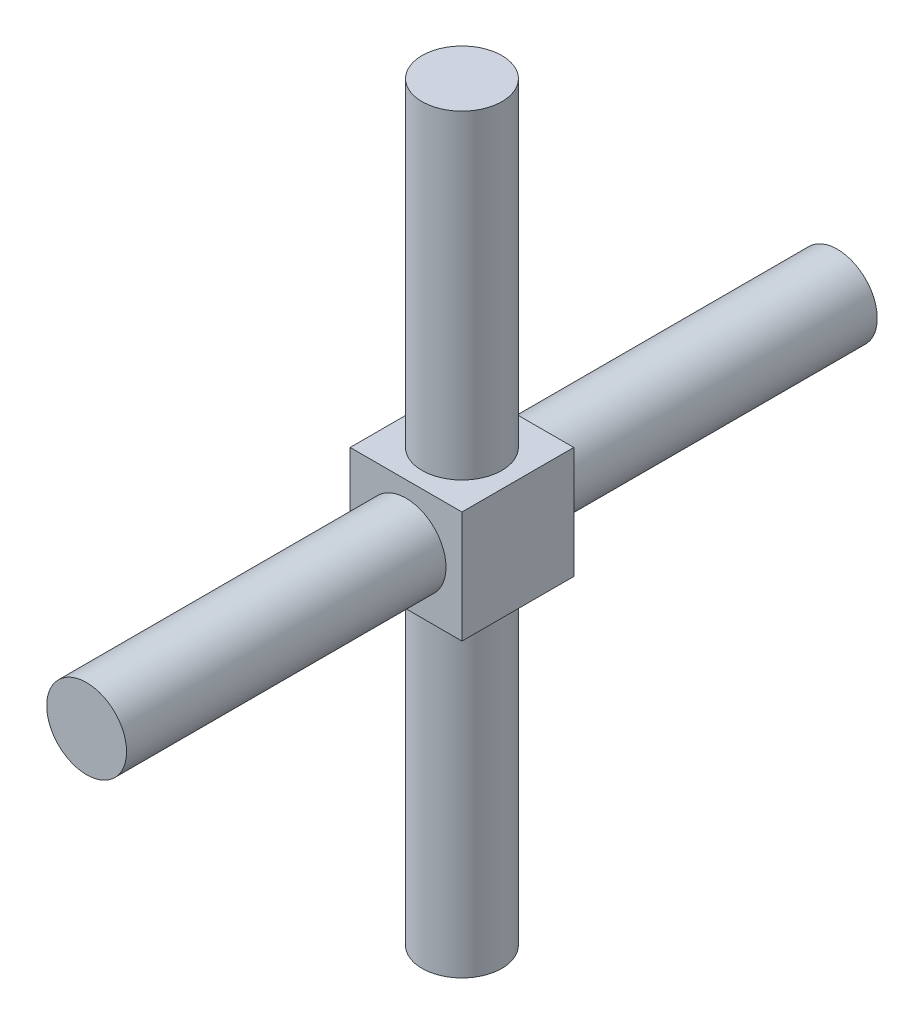
from build123d import *

# Parameters (mm, degrees)
SKETCH_1_W      = 70
SKETCH_1_H      = 70
EXTRUDE_1_DEPTH = 70
SKETCH_4_R      = 25
EXTRUDE_2_DEPTH = 200
SKETCH_5_R      = 25
EXTRUDE_3_DEPTH = 200


with BuildPart() as part:
    # 스케치1 → 보스-돌출1 (new body)
    with BuildSketch(Plane.XY):
        Rectangle(SKETCH_1_W, SKETCH_1_H)
    extrude(amount=EXTRUDE_1_DEPTH)

    # 스케치4 → 보스-돌출2 (add)
    with BuildSketch(Plane.XY.offset(70)):
        Circle(SKETCH_4_R)
    extrude_2 = extrude(amount=EXTRUDE_2_DEPTH)

    # 대칭 복사1: 보스-돌출2 across plane
    add(extrude_2.mirror(Plane.XY.offset(35)))

    # 스케치5 → 보스-돌출3 (add)
    with BuildSketch(Plane(origin=(0, 35, 0), x_dir=(1, 0, 0), z_dir=(0, 1, 0))):
        with Locations(Location((0, -35, 0), (0, 0, 180))):
            Circle(SKETCH_5_R)
    extrude_3 = extrude(amount=EXTRUDE_3_DEPTH)

    # 대칭 복사2: 보스-돌출3 across plane
    add(extrude_3.mirror(Plane.ZX))


solid = part.part
